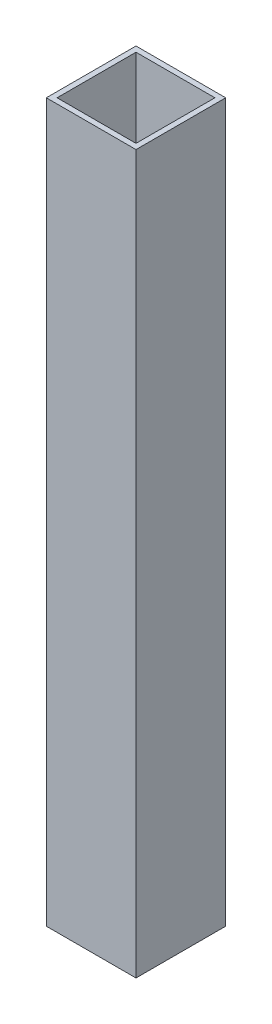
from build123d import *

# Parameters (mm, degrees)
SKETCH1_W           = 12.5
SKETCH1_H           = 12.5
SKETCH1_W_2         = 11
SKETCH1_H_2         = 11
BOSS_EXTRUDE3_DEPTH = 100


with BuildPart() as part:
    # Sketch1 → Boss-Extrude3 (new body)
    with BuildSketch(Plane(origin=(0, 0, 0), x_dir=(1, 0, 0), z_dir=(0, 1, 0))):
        with Locations((-20.377754415, -4.412827368)):
            Rectangle(SKETCH1_W, SKETCH1_H)
        with Locations((-20.377754415, -4.412827368)):
            Rectangle(SKETCH1_W_2, SKETCH1_H_2, mode=Mode.SUBTRACT)
    extrude(amount=BOSS_EXTRUDE3_DEPTH)


solid = part.part
